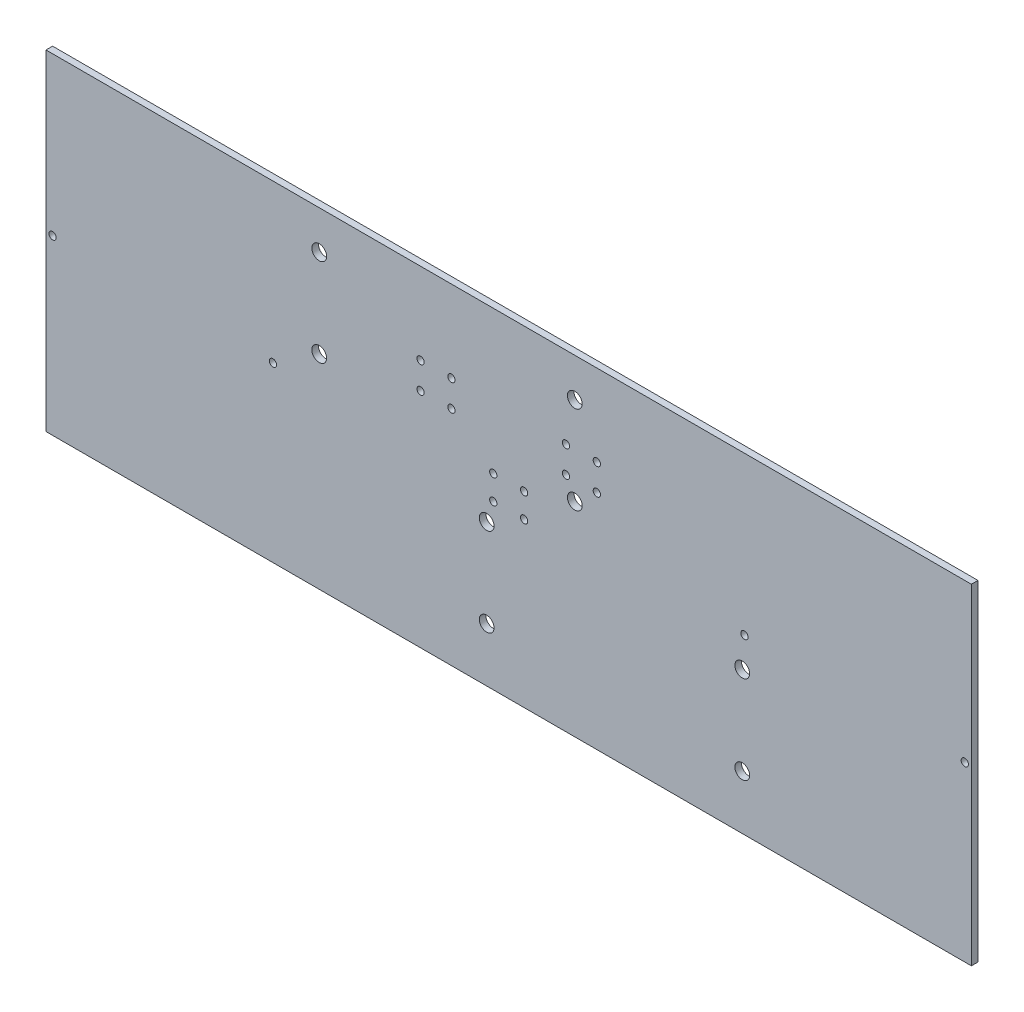
from build123d import *

# Parameters (mm, degrees)
SKETCH_2_W          = 420
SKETCH_2_H          = 180
EXTRUDE_1_DEPTH     = 3
SKETCH_3_W          = 420
SKETCH_3_H          = 3
CUT_EXTRUDE_1_DEPTH = 30
SKETCH_4_R          = 1.65
SKETCH_4_R_2        = 3.35
CUT_EXTRUDE_2_DEPTH = 40


with BuildPart() as part:
    # 草图2 → 凸台-拉伸1 (new body)
    with BuildSketch(Plane.XY):
        with Locations((210, 90)):
            Rectangle(SKETCH_2_W, SKETCH_2_H)
    extrude(amount=EXTRUDE_1_DEPTH)

    # 草图3 → 切除-拉伸1 (cut)
    with BuildSketch(Plane(origin=(0, 180, 0), x_dir=(1, 0, 0), z_dir=(0, 1, 0))):
        with Locations((210, -1.5)):
            Rectangle(SKETCH_3_W, SKETCH_3_H)
    extrude(amount=-CUT_EXTRUDE_1_DEPTH, mode=Mode.SUBTRACT)

    # 草图4 → 切除-拉伸2 (cut)
    with BuildSketch(Plane(origin=(0, 0, 0), x_dir=(-1, 0, 0), z_dir=(0, 0, -1))):
        with Locations((-250, 101)):
            Circle(SKETCH_4_R)
        with Locations((-250, 113)):
            Circle(SKETCH_4_R)
        with Locations((-236, 101)):
            Circle(SKETCH_4_R)
        with Locations((-236, 113)):
            Circle(SKETCH_4_R)
        with Locations((-217, 85)):
            Circle(SKETCH_4_R)
        with Locations((-217, 74)):
            Circle(SKETCH_4_R)
        with Locations((-203, 85)):
            Circle(SKETCH_4_R)
        with Locations((-203, 74)):
            Circle(SKETCH_4_R)
        with Locations((-184, 113)):
            Circle(SKETCH_4_R)
        with Locations((-184, 101)):
            Circle(SKETCH_4_R)
        with Locations((-170, 101)):
            Circle(SKETCH_4_R)
        with Locations((-170, 113)):
            Circle(SKETCH_4_R)
        with Locations((-417, 78.5)):
            Circle(SKETCH_4_R)
        with Locations((-317, 78.5)):
            Circle(SKETCH_4_R)
        with Locations((-3, 78.5)):
            Circle(SKETCH_4_R)
        with Locations((-103, 78.5)):
            Circle(SKETCH_4_R)
        with Locations((-316, 64.5)):
            Circle(SKETCH_4_R_2)
        with Locations((-316, 24.5)):
            Circle(SKETCH_4_R_2)
        with Locations((-200, 24.5)):
            Circle(SKETCH_4_R_2)
        with Locations((-200, 64.5)):
            Circle(SKETCH_4_R_2)
        with Locations((-240, 132.5)):
            Circle(SKETCH_4_R_2)
        with Locations((-240, 92.5)):
            Circle(SKETCH_4_R_2)
        with Locations((-124, 132.5)):
            Circle(SKETCH_4_R_2)
        with Locations((-124, 92.5)):
            Circle(SKETCH_4_R_2)
    extrude(amount=-CUT_EXTRUDE_2_DEPTH, mode=Mode.SUBTRACT)


solid = part.part
